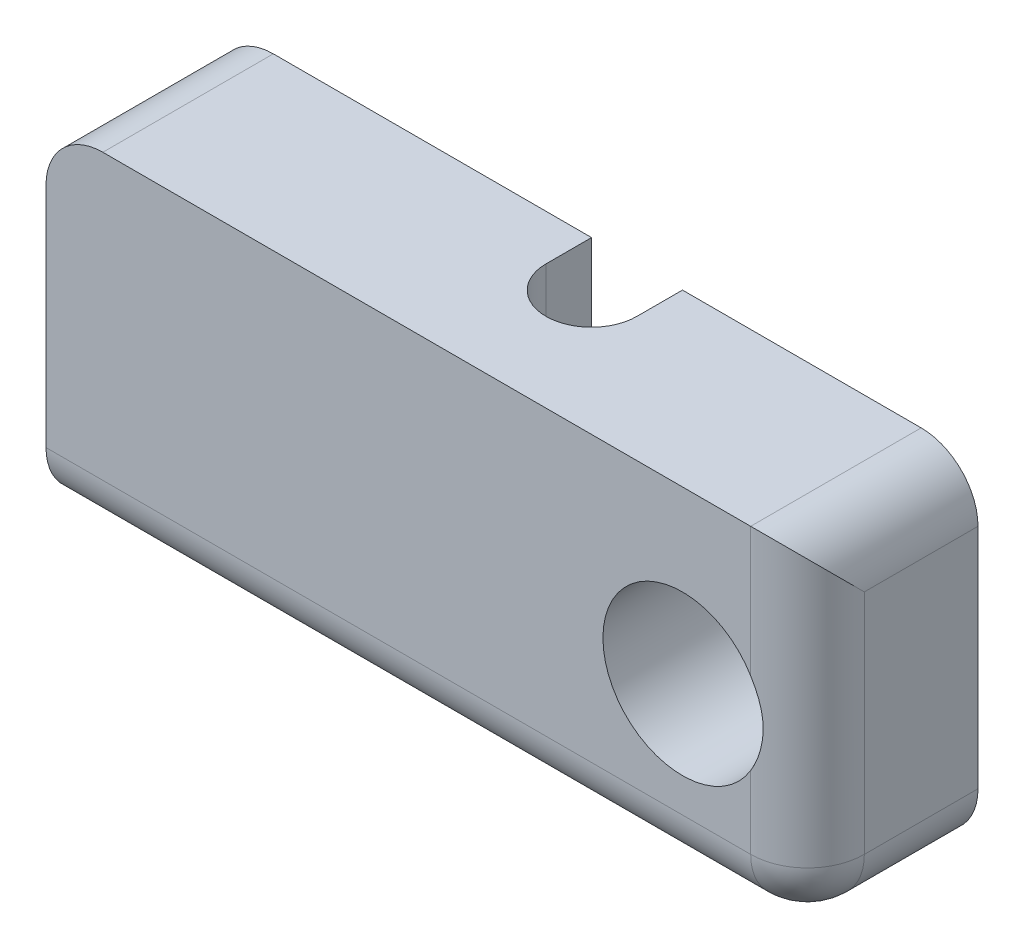
from build123d import *

# Parameters (mm, degrees)
SKETCH1_W           = 17.018
SKETCH1_H           = 7.62
BOSS_EXTRUDE1_DEPTH = 3.81
FILLET1_R           = 1.27
CUT_EXTRUDE8_REACH  = 37.332
CUT_EXTRUDE9_REACH  = 39.597
SKETCH4_R           = 1.778


with BuildPart() as part:
    # Sketch1 → Boss-Extrude1 (new body)
    with BuildSketch(Plane.XY):
        with Locations((-25.78059107, -11.13155)):
            Rectangle(SKETCH1_W, SKETCH1_H)
    extrude(amount=BOSS_EXTRUDE1_DEPTH)

    # Fillet1
    fillet1_edges = [part.edges().sort_by_distance(p)[0] for p in [
        (-17.27159107, -11.13155, 3.81),
        (-25.78059107, -14.94155, 3.81),
        (-34.28959107, -7.32155, 1.905),
        (-17.27159107, -7.32155, 1.905),
        (-17.27159107, -14.94155, 1.905),
    ]]
    fillet(fillet1_edges, radius=FILLET1_R)

    # Sketch3 → Cut-Extrude8 (cut, up to next)
    with BuildSketch(Plane.XZ.offset(14.94155), mode=Mode.PRIVATE) as cut_extrude8_sk1:
        with BuildLine():
            Line((-23.87560377, 0), (-23.87560377, 1.01854))
            ThreePointArc((-23.87560377, 1.01854), (-24.89159107, 2.0345273), (-25.90757837, 1.01854))
            Line((-25.90757837, 1.01854), (-25.90757837, 0))
            Line((-25.90757837, 0), (-23.87560377, 0))
        make_face()
    cut_extrude8_tool1 = extrude(cut_extrude8_sk1.sketch, amount=-CUT_EXTRUDE8_REACH, mode=Mode.PRIVATE) & part.part
    add(cut_extrude8_tool1.solids().sort_by_distance((-24.891591, -14.94155, 0.922401))[0], mode=Mode.SUBTRACT)

    # Sketch4 → Cut-Extrude9 (cut, up to next)
    with BuildSketch(Plane.XY.offset(3.81), mode=Mode.PRIVATE) as cut_extrude9_sk1:
        with Locations((-20.06559107, -11.13155)):
            Circle(SKETCH4_R)
    cut_extrude9_tool1 = extrude(cut_extrude9_sk1.sketch, amount=-CUT_EXTRUDE9_REACH, mode=Mode.PRIVATE) & part.part
    add(cut_extrude9_tool1.solids().sort_by_distance((-20.065591, -11.13155, 3.81))[0], mode=Mode.SUBTRACT)


solid = part.part
